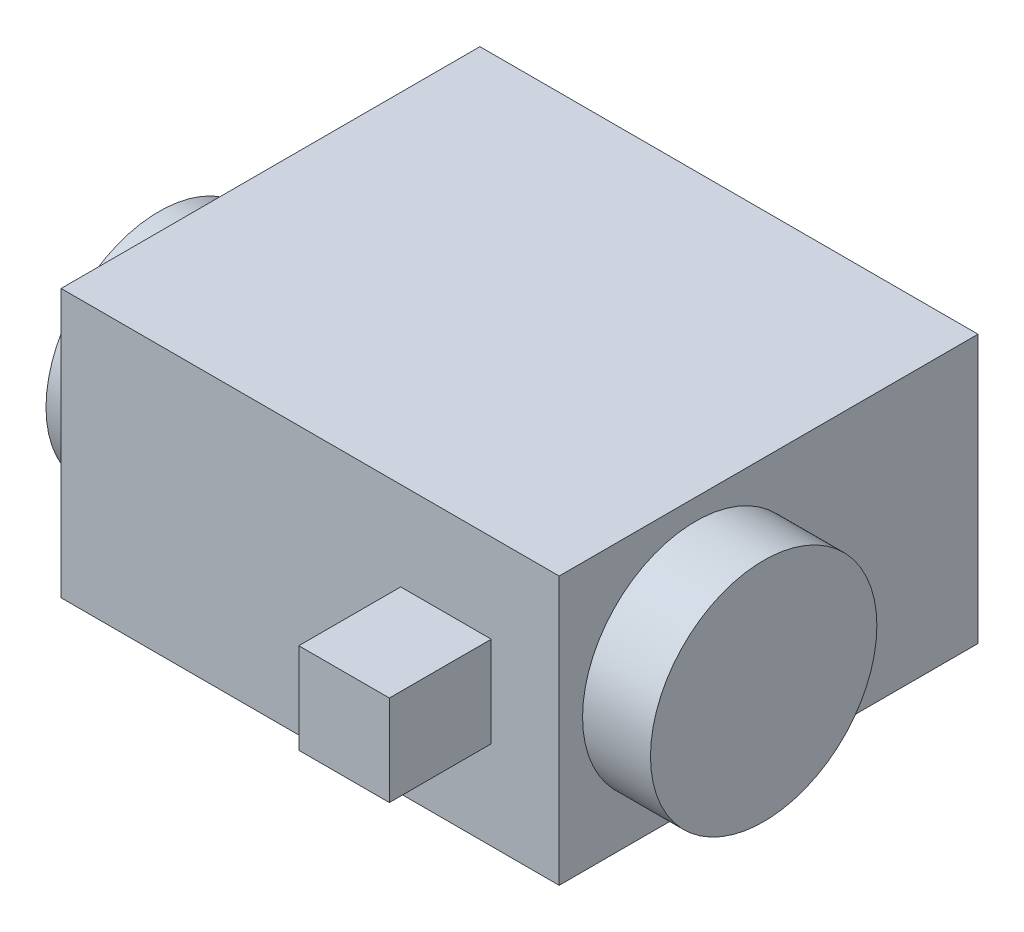
from build123d import *

# Parameters (mm, degrees)
SKETCH_1_W        = 55.5
SKETCH_1_H        = 35.5
EXTRUDE_764_DEPTH = 33
SKETCH_2_W        = 9
SKETCH_2_H        = 15
SKETCH_3_W        = 5.1
SKETCH_3_H        = 15
SKETCH_4_W        = 12
SKETCH_4_H        = 12
EXTRUDE_919_DEPTH = 31.6


with BuildPart() as part:
    # ｽｹｯﾁ1 → Extrude 764 (new, symmetric)
    with BuildSketch(Plane(origin=(0, 0, 0), x_dir=(0, 0, -1), z_dir=(1, 0, 0))):
        with Locations((9.65, 0)):
            Rectangle(SKETCH_1_W, SKETCH_1_H)
    extrude(amount=EXTRUDE_764_DEPTH, both=True)

    # ｽｹｯﾁ2 → Revolve 816 (revolve)
    with BuildSketch(Plane.XY):
        with Locations((37.5, 7.5)):
            Rectangle(SKETCH_2_W, SKETCH_2_H)
    revolve(axis=Axis((0, 0, 0), (1, 0, 0)))

    # ｽｹｯﾁ3 → Revolve 870 (revolve)
    with BuildSketch(Plane.XY):
        with Locations((-35.55, 7.5)):
            Rectangle(SKETCH_3_W, SKETCH_3_H)
    revolve(axis=Axis((0, 0, 0), (1, 0, 0)))

    # ｽｹｯﾁ4 → Extrude 919 (add, symmetric)
    with BuildSketch(Plane.XY):
        with Locations((18, 0)):
            Rectangle(SKETCH_4_W, SKETCH_4_H)
    extrude(amount=EXTRUDE_919_DEPTH, both=True)


solid = part.part
